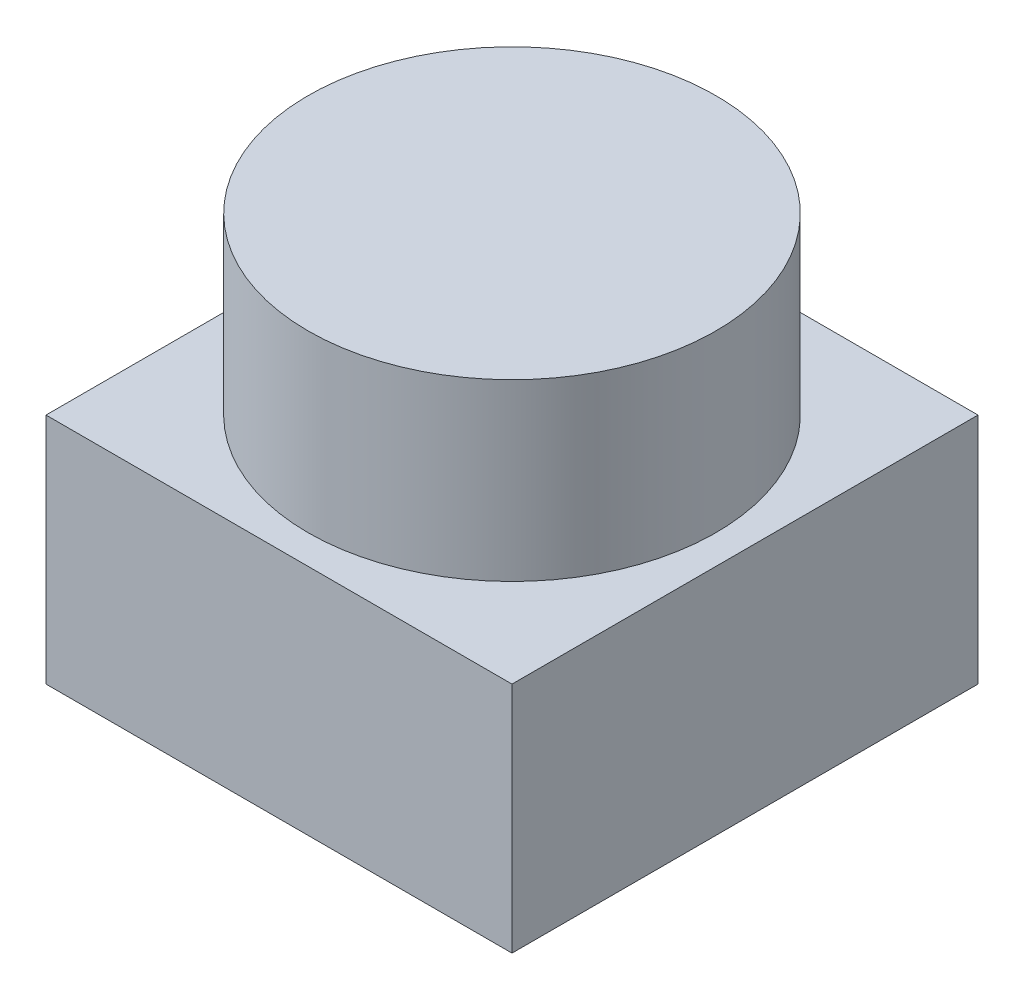
from build123d import *

# Parameters (mm, degrees)
SKETCH_1_W      = 40
SKETCH_1_H      = 40
EXTRUDE_1_DEPTH = 20
SKETCH_2_R      = 17.5
EXTRUDE_2_DEPTH = 15


with BuildPart() as part:
    # 草图1 → 凸台-拉伸1 (new body)
    with BuildSketch(Plane(origin=(0, 0, 0), x_dir=(1, 0, 0), z_dir=(0, 1, 0))):
        with Locations((2.018348624, 2.201834862)):
            Rectangle(SKETCH_1_W, SKETCH_1_H)
    extrude(amount=EXTRUDE_1_DEPTH)

    # 草图2 → 凸台-拉伸2 (add)
    with BuildSketch(Plane(origin=(0, 20, 0), x_dir=(1, 0, 0), z_dir=(0, 1, 0))):
        with Locations(Location((2.018348624, 2.201834862, 0), (0, 0, 270))):
            Circle(SKETCH_2_R)
    extrude(amount=EXTRUDE_2_DEPTH)


solid = part.part
